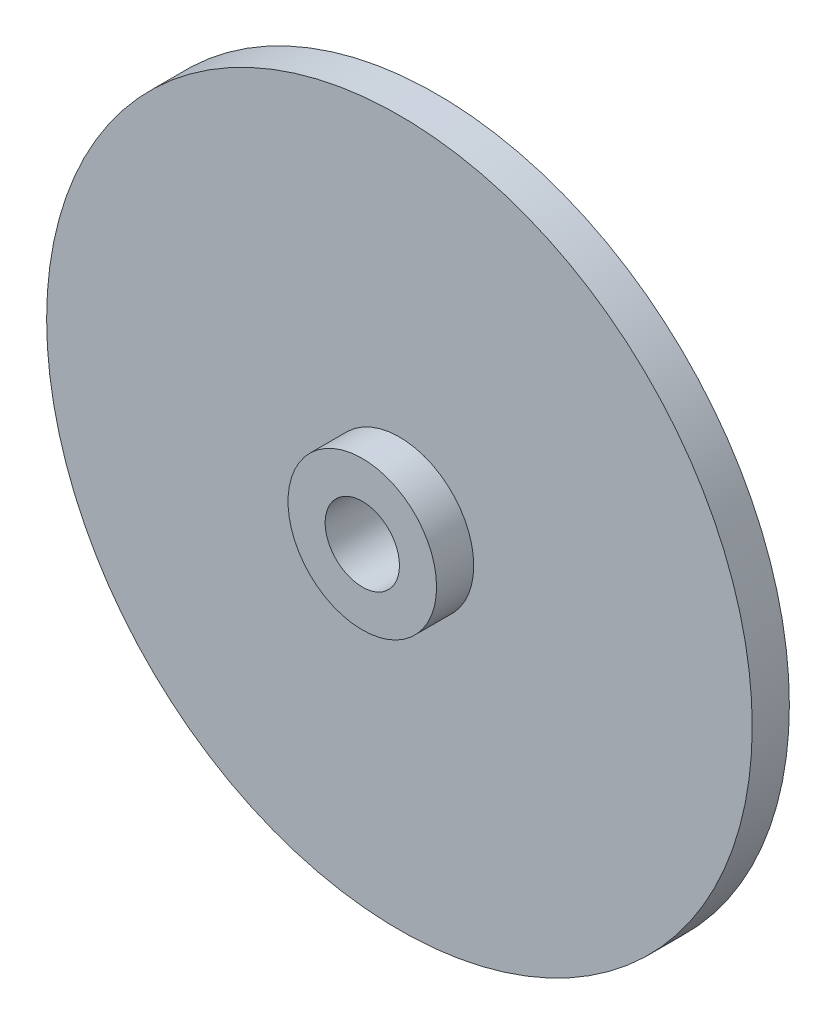
from build123d import *

# Parameters (mm, degrees)
SKETCH1_R           = 9.5
SKETCH1_R_2         = 2
BOSS_EXTRUDE1_DEPTH = 1
SKETCH1_3_R         = 2
SKETCH1_3_R_2       = 1
BOSS_EXTRUDE2_DEPTH = 2


with BuildPart() as part:
    # Sketch1 → Boss-Extrude1 (new body)
    with BuildSketch(Plane.XY):
        Circle(SKETCH1_R)
        Circle(SKETCH1_R_2, mode=Mode.SUBTRACT)
    extrude(amount=BOSS_EXTRUDE1_DEPTH)

    # Sketch1<3> → Boss-Extrude2 (add)
    with BuildSketch(Plane.XY):
        Circle(SKETCH1_3_R)
        Circle(SKETCH1_3_R_2, mode=Mode.SUBTRACT)
    extrude(amount=BOSS_EXTRUDE2_DEPTH)


solid = part.part
